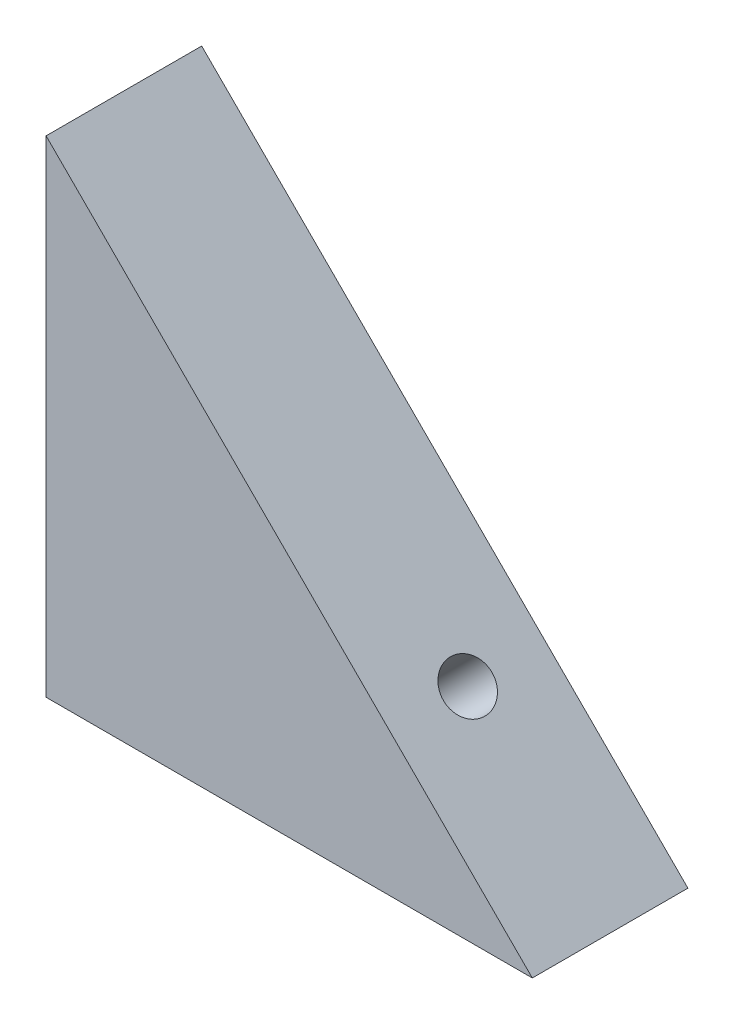
from build123d import *

# Parameters (mm, degrees)
EXTRUDE_2_DEPTH        = 8
HOLE_WIZARD_M3_2_D     = 2.5
HOLE_WIZARD_M3_2_DEPTH = 5


with BuildPart() as part:
    # 草图1 → 凸台-拉伸2 (new body)
    with BuildSketch(Plane.XY):
        Polygon((-42.3029947, -7.235847593), (-42.3029947, -32.235847593), (-17.3029947, -32.235847593), align=None)
    extrude(amount=EXTRUDE_2_DEPTH)

    # M3 螺纹孔2
    with Locations(Plane(origin=(-24.769421146, -24.769421146, 0), x_dir=(0.7071067811865439, -0.7071067811865511, 0), z_dir=(0.7071067811865511, 0.7071067811865439, 0))):
        with Locations((0.203782484, -4)):
            Hole(HOLE_WIZARD_M3_2_D / 2, depth=HOLE_WIZARD_M3_2_DEPTH)


solid = part.part
